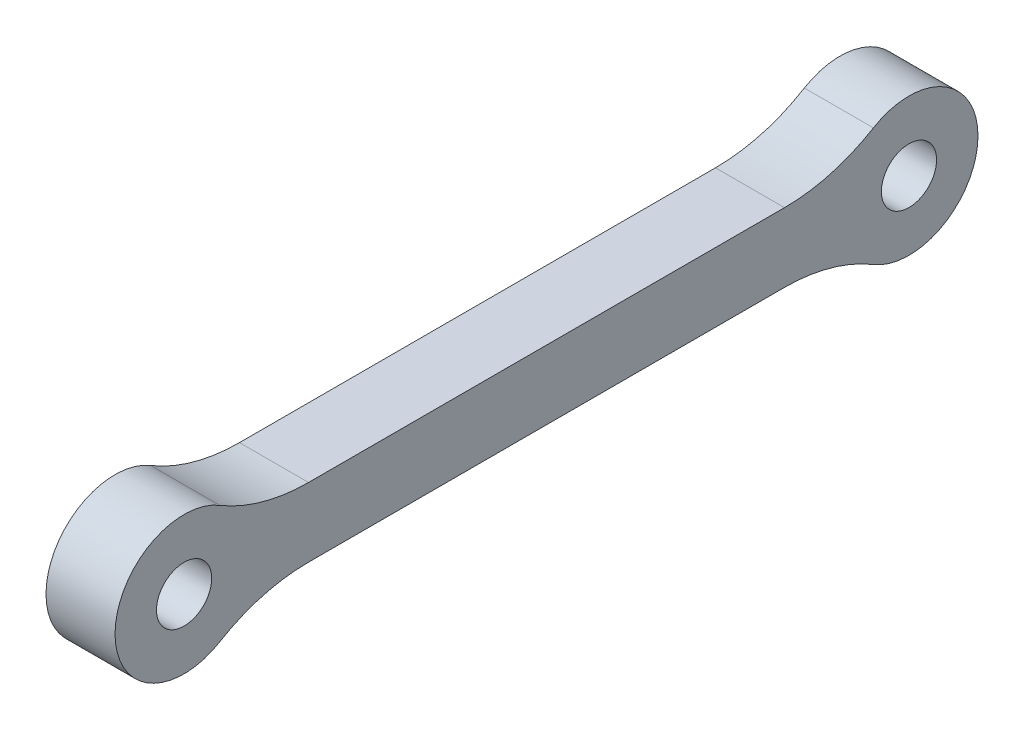
from build123d import *

# Parameters (mm, degrees)
SKETCH1_R           = 1.6
BOSS_EXTRUDE1_DEPTH = 4
FILLET1_R           = 10


with BuildPart() as part:
    # Sketch1 → Boss-Extrude1 (new body)
    with BuildSketch(Plane(origin=(0, 0, 0), x_dir=(0, 0, -1), z_dir=(1, 0, 0))):
        with BuildLine():
            Line((21, 2), (38.535898385, 2))
            ThreePointArc((38.535898385, 2), (46, 0), (38.535898385, -2))
            Line((38.535898385, -2), (21, -2))
            Line((21, -2), (3.464101615, -2))
            ThreePointArc((3.464101615, -2), (-4, 0), (3.464101615, 2))
            Line((3.464101615, 2), (21, 2))
        make_face()
        Circle(SKETCH1_R, mode=Mode.SUBTRACT)
        with Locations((42, 0)):
            Circle(SKETCH1_R, mode=Mode.SUBTRACT)
    extrude(amount=BOSS_EXTRUDE1_DEPTH)

    # Fillet1
    fillet1_edges = [part.edges().sort_by_distance(p)[0] for p in [
        (2, 2, -38.535898385),
        (2, -2, -38.535898385),
        (2, -2, -3.464101615),
        (2, 2, -3.464101615),
    ]]
    fillet(fillet1_edges, radius=FILLET1_R)


solid = part.part
